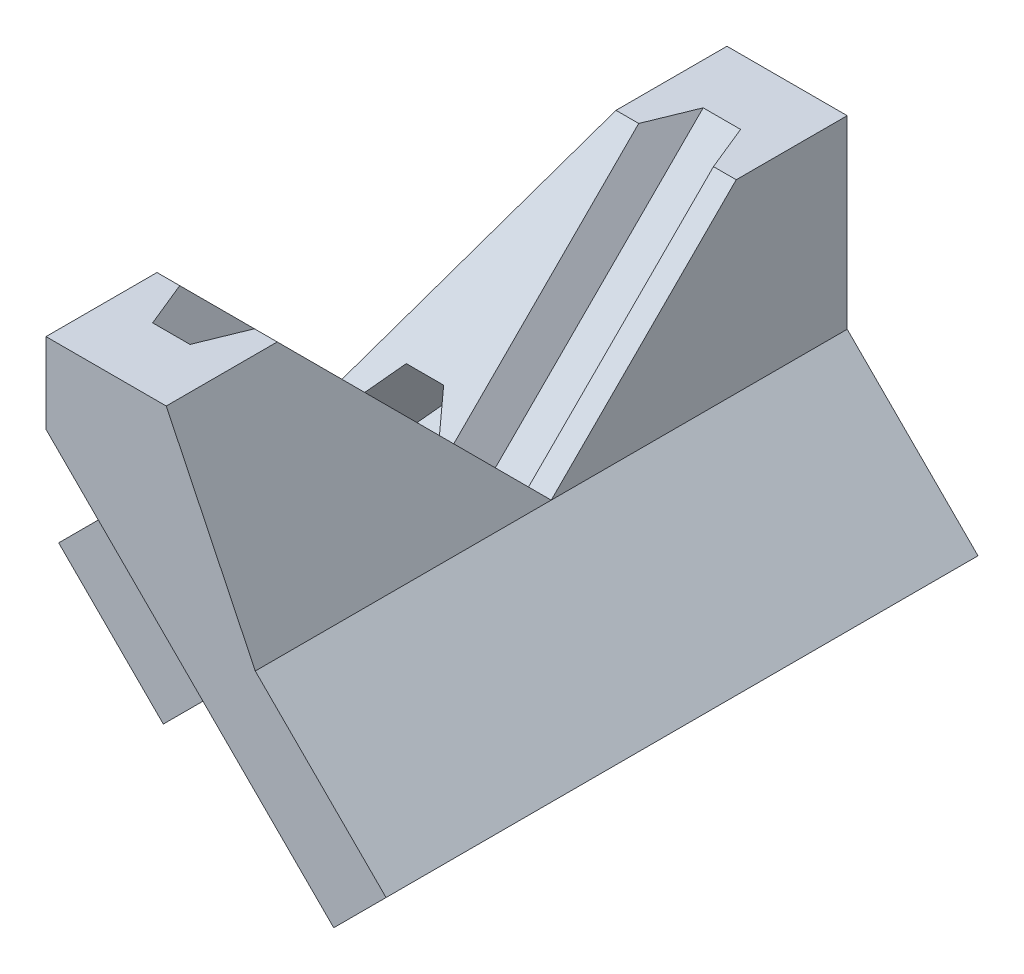
from build123d import *

# Parameters (mm, degrees)
BOSS_EXTRUDE1_DEPTH      = 32
BOSS_EXTRUDE3_DEPTH      = 5.65685
BOSS_EXTRUDE3_DEPTH_BACK = 5.656854
BOSS_EXTRUDE4_REACH      = 42.757
CUT_EXTRUDE1_DEPTH       = 37.750380653
CUT_EXTRUDE1_DEPTH_BACK  = 4
CUT_EXTRUDE2_DEPTH       = 40.313965438
CUT_EXTRUDE2_DEPTH_BACK  = 4
SKETCH7_W                = 12
SKETCH7_H                = 20
CUT_EXTRUDE5_DEPTH       = 41.757049513
CUT_EXTRUDE3_REACH       = 43.881
SKETCH6_R                = 2.75
SKETCH8_R                = 4.75
CUT_EXTRUDE6_DEPTH       = 3
CUT_EXTRUDE7_REACH       = 42.757
CUT_EXTRUDE8_REACH       = 42.757
CUT_EXTRUDE9_REACH       = 43.881
BOSS_EXTRUDE5_DEPTH      = 8
CUT_EXTRUDE11_REACH      = 47.4
CHAMFER7_SIZE            = 4
BODY_MOVE_COPY1_ANGLE    = 180


with BuildPart() as part:
    # Sketch1 → Boss-Extrude1 (new body)
    with BuildSketch(Plane.XY):
        Polygon((0, 0), (14.142135624, -14.142135624), (19.798989873, -8.485281374), (5.656854249, 5.656854249), (-5.656854249, 5.656854249), align=None)
    extrude(amount=BOSS_EXTRUDE1_DEPTH)

    # Sketch2 → Boss-Extrude3 (add, two sides: drawn at the far end of the back side and taken through both)
    with BuildSketch(Plane(origin=(0, 0, 0), x_dir=(0, 0, -1), z_dir=(1, 0, 0)).offset(-BOSS_EXTRUDE3_DEPTH_BACK)):
        Polygon((-32, 15.656854249), (-32, 5.656854249), (-16, 5.656854249), (-26, 15.656854249), align=None)
        Polygon((-6, 15.656854249), (-16, 5.656854249), (0, 5.656854249), (0, 15.656854249), align=None)
    extrude(amount=BOSS_EXTRUDE3_DEPTH + BOSS_EXTRUDE3_DEPTH_BACK)

    # Boss-Extrude4: up to this face of the body (flat: up to its plane)
    boss_extrude4_end = Plane(part.part.faces().sort_by_distance((5.190844624, 2.122135002, 0))[0])
    # Sketch5 → Boss-Extrude4 (add, up to the picked face)
    with BuildSketch(Plane.XY.offset(32), mode=Mode.PRIVATE) as boss_extrude4_sk1:
        Polygon((-5.656854249, 5.656854249), (-12.727922061, -1.414213562), (-4.242640687, -9.899494937), (-2.121320344, -7.778174593), (-4.949747468, -4.949747468), (0, 0), align=None)
    boss_extrude4_tool1 = split(extrude(boss_extrude4_sk1.sketch, amount=-BOSS_EXTRUDE4_REACH, mode=Mode.PRIVATE), bisect_by=boss_extrude4_end, keep=Keep.BOTH, mode=Mode.PRIVATE)
    add(boss_extrude4_tool1.solids().sort_by(Axis((-6.133383, -1.583304, 32), (0, 0, -1)))[0])

    # Sketch3 → Cut-Extrude1 (cut, two sides: drawn at the far end of the back side and taken through both)
    with BuildSketch(Plane(origin=(0, -3.029437252, 24.686291501), x_dir=(1, 0, 0), z_dir=(0, 0.7071067811865488, 0.7071067811865464)).offset(-CUT_EXTRUDE1_DEPTH_BACK)):
        Polygon((-1.396491278, 14.034271247), (-3.417217221, 14.034271247), (-4.427580192, 12.284271247), (-3.417217221, 10.534271247), (-1.396491278, 10.534271247), (-0.386128307, 12.284271247), align=None)
    extrude(amount=CUT_EXTRUDE1_DEPTH + CUT_EXTRUDE1_DEPTH_BACK, mode=Mode.SUBTRACT)

    # Sketch4 → Cut-Extrude2 (cut, two sides: drawn at the far end of the back side and taken through both)
    with BuildSketch(Plane(origin=(0, -5.171572875, 5.171572875), x_dir=(1, 0, 0), z_dir=(0, 0.707106781186549, -0.7071067811865461)).offset(-CUT_EXTRUDE2_DEPTH_BACK)):
        Polygon((4.427580192, -15.313708499), (3.417217221, -13.563708499), (1.396491278, -13.563708499), (0.386128307, -15.313708499), (1.396491278, -17.063708499), (3.417217221, -17.063708499), align=None)
    extrude(amount=CUT_EXTRUDE2_DEPTH + CUT_EXTRUDE2_DEPTH_BACK, mode=Mode.SUBTRACT)

    # Sketch7 → Cut-Extrude5 (cut, through all)
    with BuildSketch(Plane(origin=(0, 0, 0), x_dir=(0, 0, 1), z_dir=(-0.7071067811865477, -0.7071067811865475, 0))):
        with Locations((6, -10)):
            Rectangle(SKETCH7_W, SKETCH7_H)
    extrude(amount=-CUT_EXTRUDE5_DEPTH, mode=Mode.SUBTRACT)

    # Sketch6 → Cut-Extrude3 (cut, up to next)
    with BuildSketch(Plane(origin=(5.656854249, 5.656854249, 0), x_dir=(0, 0, -1), z_dir=(0.7071067811865472, 0.7071067811865479, 0)), mode=Mode.PRIVATE) as cut_extrude3_sk1:
        with Locations(Location((-22, -10, 0), (0, 0, 90))):
            Circle(SKETCH6_R)
    cut_extrude3_tool1 = extrude(cut_extrude3_sk1.sketch, amount=-CUT_EXTRUDE3_REACH, mode=Mode.PRIVATE) & part.part
    add(cut_extrude3_tool1.solids().sort_by_distance((12.727922, -1.414214, 22))[0], mode=Mode.SUBTRACT)

    # Sketch8 → Cut-Extrude6 (cut)
    with BuildSketch(Plane(origin=(5.656854249, 5.656854249, 0), x_dir=(0, 0, -1), z_dir=(0.7071067811865472, 0.7071067811865479, 0))):
        with Locations(Location((-22, -10, 0), (0, 0, 90))):
            Circle(SKETCH8_R)
    extrude(amount=-CUT_EXTRUDE6_DEPTH, mode=Mode.SUBTRACT)

    # Cut-Extrude7: up to this plane
    cut_extrude7_end = Plane(origin=(5.656854249, -4.952452979, 5.390692772), z_dir=(0, 0.7071067811865491, -0.707106781186546))
    # Sketch9 → Cut-Extrude7 (cut, up to the surface)
    with BuildSketch(Plane.XY.offset(32), mode=Mode.PRIVATE) as cut_extrude7_sk1:
        Polygon((0.843145751, 15.656854249), (5.656854249, 5.656854249), (5.656854249, 15.656854249), align=None)
    cut_extrude7_tool1 = split(extrude(cut_extrude7_sk1.sketch, amount=-CUT_EXTRUDE7_REACH, mode=Mode.PRIVATE), bisect_by=cut_extrude7_end, keep=Keep.BOTH, mode=Mode.PRIVATE)
    add(cut_extrude7_tool1.solids().sort_by_distance((4.052285, 12.323521, 32))[0], mode=Mode.SUBTRACT)

    # Cut-Extrude8: up to this plane
    cut_extrude8_end = Plane(origin=(5.656854249, 21.266161478, 0.390692772), z_dir=(0, -0.7071067811865489, -0.7071067811865462))
    # Sketch10 → Cut-Extrude8 (cut, up to the surface)
    with BuildSketch(Plane(origin=(0, 0, 0), x_dir=(-1, 0, 0), z_dir=(0, 0, -1)), mode=Mode.PRIVATE) as cut_extrude8_sk1:
        Polygon((0.843145751, 15.656854249), (5.656854249, 5.656854249), (5.656854249, 15.656854249), align=None)
    cut_extrude8_tool1 = split(extrude(cut_extrude8_sk1.sketch, amount=-CUT_EXTRUDE8_REACH, mode=Mode.PRIVATE), bisect_by=cut_extrude8_end, keep=Keep.BOTH, mode=Mode.PRIVATE)
    add(cut_extrude8_tool1.solids().sort_by_distance((-4.052285, 12.323521, 0))[0], mode=Mode.SUBTRACT)

    # Sketch11 → Cut-Extrude9 (cut, up to next)
    with BuildSketch(Plane(origin=(5.656854249, 5.656854249, 0), x_dir=(0, 0, -1), z_dir=(0.7071067811865472, 0.7071067811865478, 0)), mode=Mode.PRIVATE) as cut_extrude9_sk1:
        Polygon((-12, -16), (-16, -20), (-12, -20), align=None)
    cut_extrude9_tool1 = extrude(cut_extrude9_sk1.sketch, amount=-CUT_EXTRUDE9_REACH, mode=Mode.PRIVATE) & part.part
    add(cut_extrude9_tool1.solids().sort_by_distance((18.856181, -7.542472, 13.333333))[0], mode=Mode.SUBTRACT)

    # Sketch12 → Boss-Extrude5 (add)
    with BuildSketch(Plane(origin=(5.656854249, 5.656854249, 0), x_dir=(0, 0, -1), z_dir=(0.7071067811865472, 0.7071067811865478, 0))):
        Polygon((-12, -4), (-8, 0), (-12, 0), align=None)
    extrude(amount=-BOSS_EXTRUDE5_DEPTH)

    # Sketch14 → Cut-Extrude11 (cut, up to next)
    with BuildSketch(Plane(origin=(-4.949747468, -4.949747468, 0), x_dir=(0, 0, -1), z_dir=(0.7071067811865476, 0.7071067811865476, 0)), mode=Mode.PRIVATE) as cut_extrude11_sk1:
        Polygon((-8, 0), (0, 0), (0, -4), (-12, -4), align=None)
    cut_extrude11_tool1 = extrude(cut_extrude11_sk1.sketch, amount=-CUT_EXTRUDE11_REACH, mode=Mode.PRIVATE) & part.part
    add(cut_extrude11_tool1.solids().sort_by_distance((-3.441253, -6.458242, 5.066667))[0], mode=Mode.SUBTRACT)

    # Chamfer7
    chamfer7_edges = [part.edges().sort_by_distance(p)[0] for p in [
        (-0.7071067811865497, -0.7071067811865479, 0),
    ]]
    chamfer(chamfer7_edges, length=CHAMFER7_SIZE)


with BuildPart() as part_1:
    # Body-Move/Copy1: moved
    add(part.part.rotate(Axis((2.828427125, 0, 16), (0, 1, 0)), BODY_MOVE_COPY1_ANGLE))


solid = part_1.part
